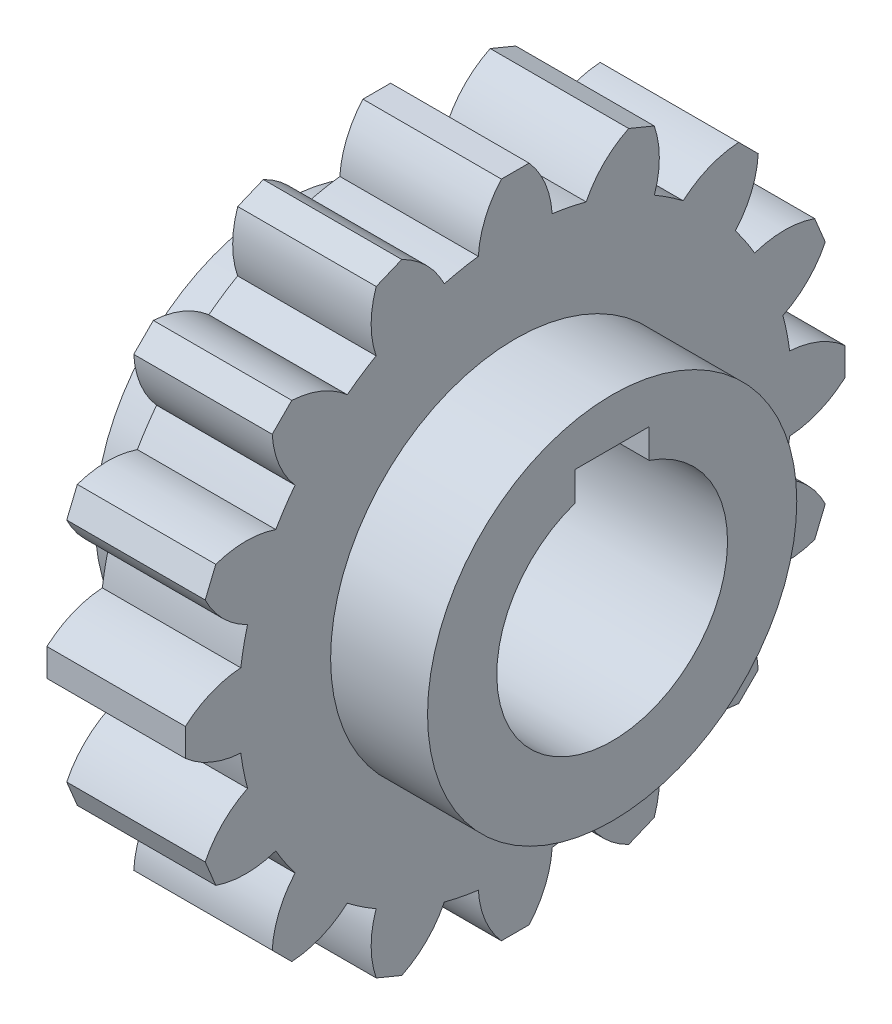
from build123d import *

# Parameters (mm, degrees)
SKETCH1_R           = 30
BOSS_EXTRUDE1_DEPTH = 7.5
BOSS_EXTRUDE2_DEPTH = 15
CIRPATTERN1_COUNT   = 16
SKETCH3_R           = 20
BOSS_EXTRUDE3_DEPTH = 18
CUT_EXTRUDE1_DEPTH  = 63.04491357


with BuildPart() as part:
    # Sketch1 → Boss-Extrude1 (new, symmetric)
    with BuildSketch(Plane(origin=(0, 0, 0), x_dir=(0, 0, -1), z_dir=(1, 0, 0))):
        Circle(SKETCH1_R)
    extrude(amount=BOSS_EXTRUDE1_DEPTH, both=True)

    # Sketch2 → Boss-Extrude2 (add)
    with BuildSketch(Plane(origin=(7.5, 0, 0), x_dir=(0, 0, -1), z_dir=(1, 0, 0))):
        with BuildLine():
            Line((-1.5, 35.732137495), (1.5, 35.732137495))
            ThreePointArc((1.5, 35.732137495), (3.251101391, 32.940929741), (4, 29.732137495))
            ThreePointArc((4, 29.732137495), (0, 30), (-4, 29.732137495))
            ThreePointArc((-4, 29.732137495), (-3.251101391, 32.940929741), (-1.5, 35.732137495))
        make_face()
    boss_extrude2 = extrude(amount=-BOSS_EXTRUDE2_DEPTH)

    # CirPattern1: Boss-Extrude2 ×16 about axis
    cirpattern1_axis = Axis((0, 0, 0), (1, 0, 0))
    for i in range(1, CIRPATTERN1_COUNT):
        add(boss_extrude2.rotate(cirpattern1_axis, i * 360 / CIRPATTERN1_COUNT))

    # Sketch3 → Boss-Extrude3 (add, symmetric)
    with BuildSketch(Plane(origin=(0, 0, 0), x_dir=(0, 0, -1), z_dir=(1, 0, 0))):
        Circle(SKETCH3_R)
    extrude(amount=BOSS_EXTRUDE3_DEPTH, both=True)

    # Sketch4 → Cut-Extrude1 (cut, through all)
    with BuildSketch(Plane(origin=(18, 0, 0), x_dir=(0, 0, -1), z_dir=(1, 0, 0))):
        with BuildLine():
            Line((-4, 15), (4, 15))
            Line((4, 15), (4, 11.842719282))
            ThreePointArc((4, 11.842719282), (0, -12.5), (-4, 11.842719282))
            Line((-4, 11.842719282), (-4, 15))
        make_face()
    extrude(amount=-CUT_EXTRUDE1_DEPTH, mode=Mode.SUBTRACT)


solid = part.part
